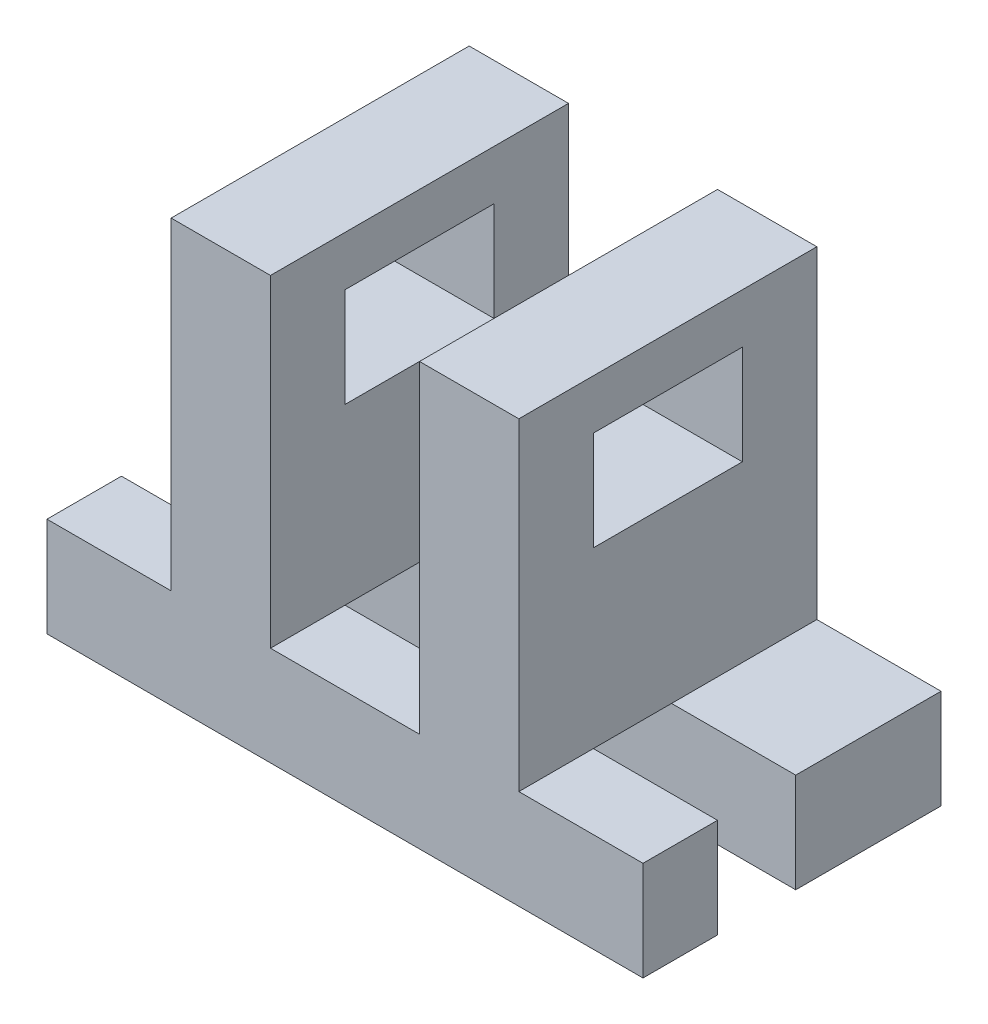
from build123d import *

# Parameters (mm, degrees)
BOSS_EXTRUDE1_DEPTH     = 3
SKETCH4_W               = 12
SKETCH4_H               = 1.5748
CUT_EXTRUDE3_DEPTH      = 2
CUT_EXTRUDE4_DEPTH      = 13.469963913
CUT_EXTRUDE4_DEPTH_BACK = 13.469963913
SKETCH5_W               = 3
SKETCH5_H               = 2


with BuildPart() as part:
    # Sketch1 → Boss-Extrude1 (new, symmetric)
    with BuildSketch(Plane.XY):
        Polygon((-6, -1), (6, -1), (6, 1), (3.5, 1), (3.5, 7.5), (1.5, 7.5), (1.5, 1), (-1.5, 1), (-1.5, 7.5), (-3.5, 7.5), (-3.5, 1), (-6, 1), align=None)
    extrude(amount=BOSS_EXTRUDE1_DEPTH, both=True)

    # Sketch4 → Cut-Extrude3 (cut)
    with BuildSketch(Plane.XZ.offset(1)):
        with Locations((0, 0.7126)):
            Rectangle(SKETCH4_W, SKETCH4_H)
    extrude(amount=-CUT_EXTRUDE3_DEPTH, mode=Mode.SUBTRACT)

    # Sketch5 → Cut-Extrude4 (cut, two sides: drawn at the far end of the back side and taken through both)
    with BuildSketch(Plane.ZY.offset(3.5).offset(-CUT_EXTRUDE4_DEPTH_BACK)):
        with Locations((0, 5.5)):
            Rectangle(SKETCH5_W, SKETCH5_H)
    extrude(amount=CUT_EXTRUDE4_DEPTH + CUT_EXTRUDE4_DEPTH_BACK, mode=Mode.SUBTRACT)


solid = part.part
